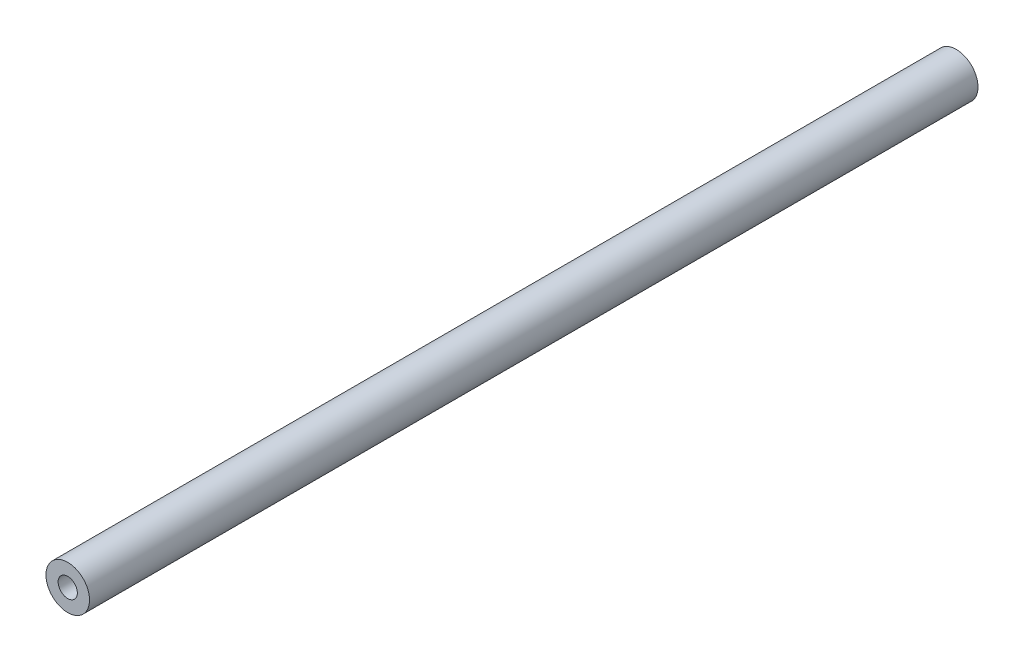
from build123d import *

# Parameters (mm, degrees)
SKETCH1_R                       = 3.96875
BOSS_EXTRUDE1_DEPTH             = 80.9625
F_6_32_TAPPED_HOLE1_D           = 2.7051
F_6_32_TAPPED_HOLE1_DEPTH       = 9.398
F_6_32_TAPPED_HOLE1_CBORE_D     = 3.5052
F_6_32_TAPPED_HOLE1_CBORE_DEPTH = 7.112
F_6_32_TAPPED_HOLE1_TIP         = 0.81269403
F_6_32_TAPPED_HOLE2_D           = 2.7051
F_6_32_TAPPED_HOLE2_DEPTH       = 9.398
F_6_32_TAPPED_HOLE2_CBORE_D     = 3.5052
F_6_32_TAPPED_HOLE2_CBORE_DEPTH = 7.112
F_6_32_TAPPED_HOLE2_TIP         = 0.81269403


with BuildPart() as part:
    # Sketch1 → Boss-Extrude1 (new, symmetric)
    with BuildSketch(Plane.XY):
        Circle(SKETCH1_R)
    extrude(amount=BOSS_EXTRUDE1_DEPTH, both=True)

    # #6-32 Tapped Hole1
    with Locations(Plane(origin=(0, 0, -80.9625), x_dir=(-1, 0, 0), z_dir=(0, 0, -1))):
        with Locations((0, 0)):
            CounterBoreHole(F_6_32_TAPPED_HOLE1_D / 2, F_6_32_TAPPED_HOLE1_CBORE_D / 2, F_6_32_TAPPED_HOLE1_CBORE_DEPTH, depth=F_6_32_TAPPED_HOLE1_DEPTH)
            with Locations((0, 0, -(F_6_32_TAPPED_HOLE1_DEPTH + F_6_32_TAPPED_HOLE1_TIP / 2))):  # 118° drill point
                Cone(0, F_6_32_TAPPED_HOLE1_D / 2, F_6_32_TAPPED_HOLE1_TIP, mode=Mode.SUBTRACT)

    # #6-32 Tapped Hole2
    with Locations(Plane.XY.offset(80.9625)):
        with Locations((0, 0)):
            CounterBoreHole(F_6_32_TAPPED_HOLE2_D / 2, F_6_32_TAPPED_HOLE2_CBORE_D / 2, F_6_32_TAPPED_HOLE2_CBORE_DEPTH, depth=F_6_32_TAPPED_HOLE2_DEPTH)
            with Locations((0, 0, -(F_6_32_TAPPED_HOLE2_DEPTH + F_6_32_TAPPED_HOLE2_TIP / 2))):  # 118° drill point
                Cone(0, F_6_32_TAPPED_HOLE2_D / 2, F_6_32_TAPPED_HOLE2_TIP, mode=Mode.SUBTRACT)


solid = part.part
